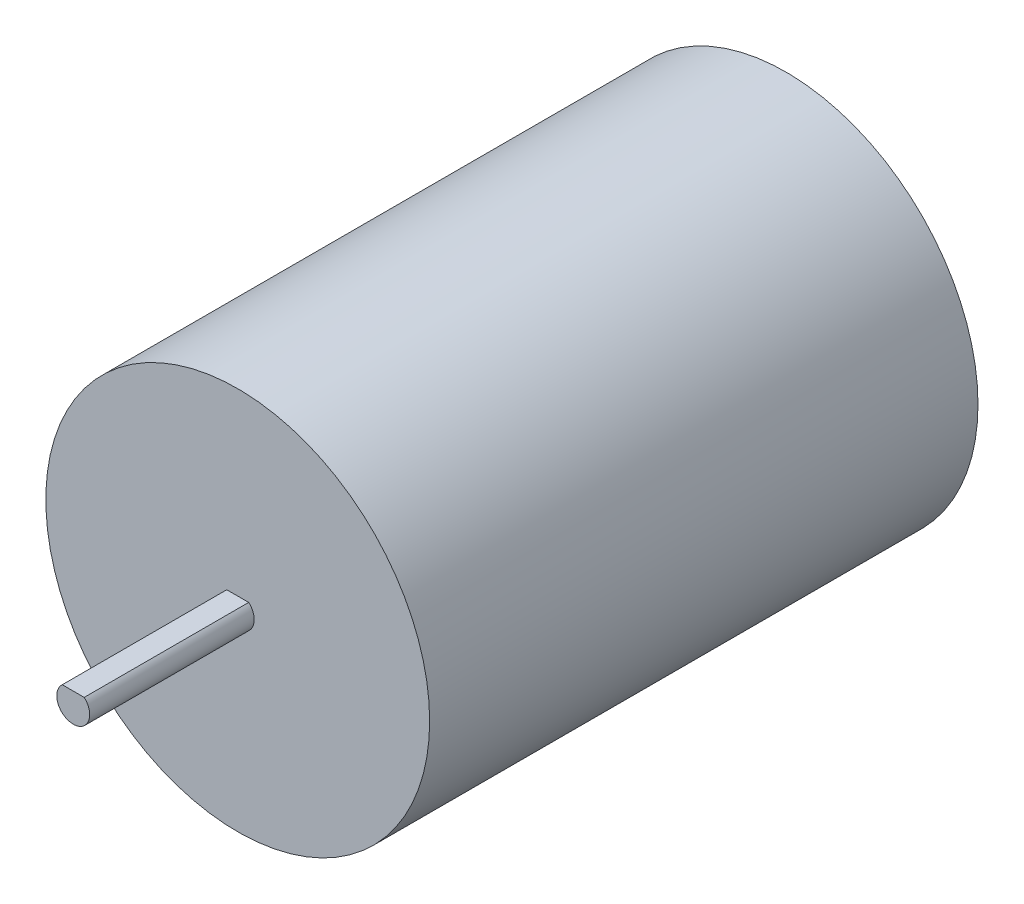
from build123d import *

# Parameters (mm, degrees)
SKETCH1_R           = 17.5
BOSS_EXTRUDE1_DEPTH = 50
BOSS_EXTRUDE5_DEPTH = 15


with BuildPart() as part:
    # Sketch1 → Boss-Extrude1 (new body)
    with BuildSketch(Plane.XY):
        Circle(SKETCH1_R)
    extrude(amount=BOSS_EXTRUDE1_DEPTH)

    # Sketch7 → Boss-Extrude5 (add)
    with BuildSketch(Plane.XY.offset(50)):
        with BuildLine():
            Line((-1, 1.118033989), (1, 1.118033989))
            ThreePointArc((1, 1.118033989), (0, -1.5), (-1, 1.118033989))
        make_face()
    extrude(amount=BOSS_EXTRUDE5_DEPTH)


solid = part.part
